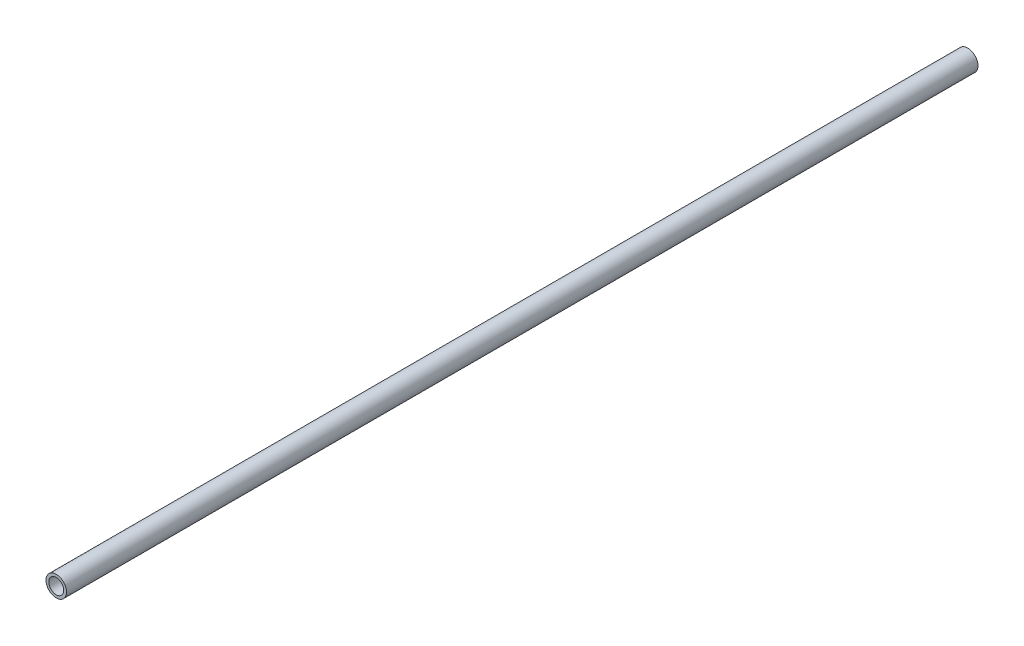
from build123d import *

# Parameters (mm, degrees)
SKETCH1_R           = 8.5725
SKETCH1_R_2         = 6.2611
EXTRUDE_THIN1_DEPTH = 381


with BuildPart() as part:
    # Sketch1 → Extrude-Thin1 (new, symmetric)
    with BuildSketch(Plane.XY):
        Circle(SKETCH1_R)
        Circle(SKETCH1_R_2, mode=Mode.SUBTRACT)
    extrude(amount=EXTRUDE_THIN1_DEPTH, both=True)


solid = part.part
